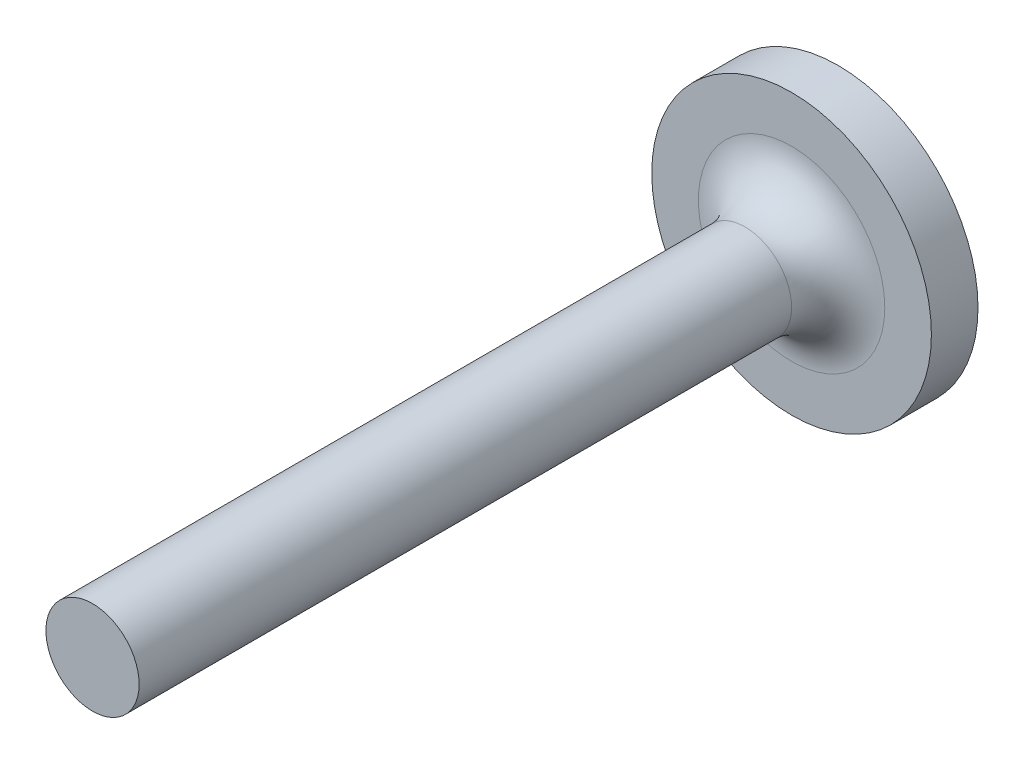
from build123d import *

# Parameters (mm, degrees)
SKETCH1_R           = 6
BOSS_EXTRUDE1_DEPTH = 2
SKETCH2_R           = 2
BOSS_EXTRUDE2_DEPTH = 35
FILLET1_R           = 2
CUT_EXTRUDE1_START  = -5
SKETCH4_R           = 2
CUT_EXTRUDE1_DEPTH  = 5


with BuildPart() as part:
    # Sketch1 → Boss-Extrude1 (new body)
    with BuildSketch(Plane.XY):
        Circle(SKETCH1_R)
    extrude(amount=BOSS_EXTRUDE1_DEPTH)

    # Sketch2 → Boss-Extrude2 (add)
    with BuildSketch(Plane.XY.offset(2)):
        Circle(SKETCH2_R)
    extrude(amount=BOSS_EXTRUDE2_DEPTH)

    # Fillet1
    fillet1_edges = [part.edges().sort_by_distance(p)[0] for p in [
        (-2, 0, 2),
    ]]
    fillet(fillet1_edges, radius=FILLET1_R)

    # Sketch4 → Cut-Extrude1 (cut)
    with BuildSketch(Plane.XY.offset(37).offset(CUT_EXTRUDE1_START)):
        Circle(SKETCH4_R)
    extrude(amount=CUT_EXTRUDE1_DEPTH, mode=Mode.SUBTRACT)


solid = part.part
